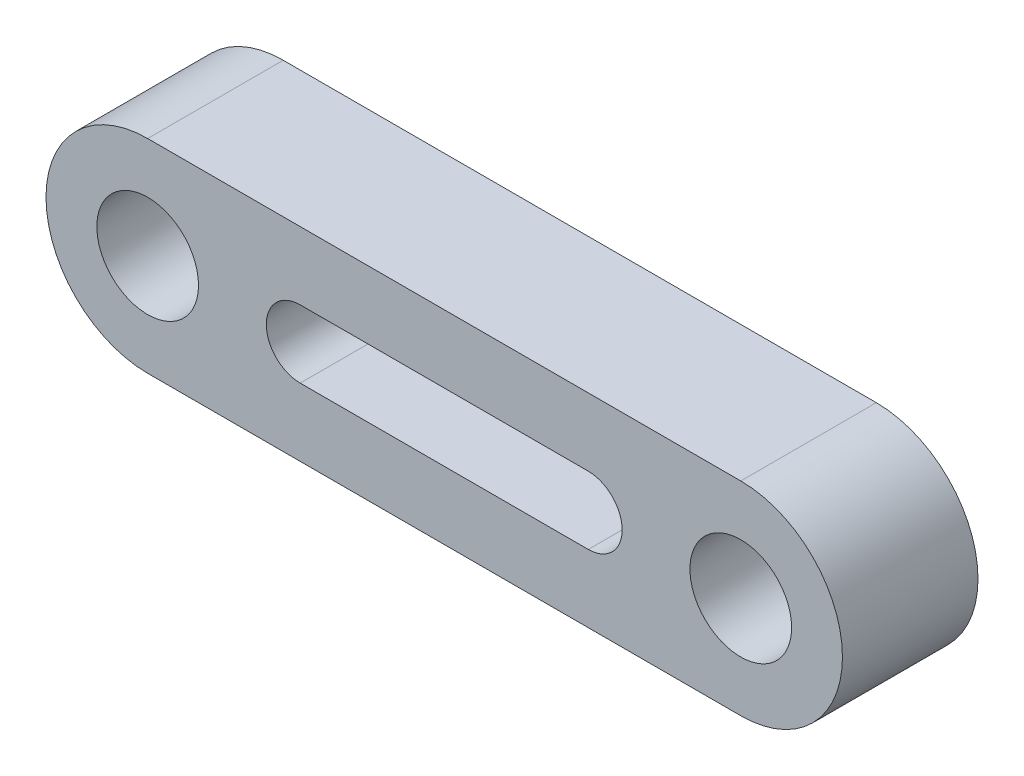
from build123d import *

# Parameters (mm, degrees)
ESQUISSE1_R             = 1.5
BOSS_EXTRU_1_DEPTH      = 4
ENL_V_MAT_EXTRU_1_REACH = 23.101


with BuildPart() as part:
    # Esquisse1 → Boss.-Extru.1 (new body)
    with BuildSketch(Plane.XY):
        with BuildLine():
            Line((0, 3), (17.5, 3))
            ThreePointArc((17.5, 3), (20.5, 0), (17.5, -3))
            Line((17.5, -3), (0, -3))
            ThreePointArc((0, -3), (-3, 0), (0, 3))
        make_face()
        Circle(ESQUISSE1_R, mode=Mode.SUBTRACT)
        with Locations((17.5, 0)):
            Circle(ESQUISSE1_R, mode=Mode.SUBTRACT)
    extrude(amount=BOSS_EXTRU_1_DEPTH)

    # Esquisse2 → Enlèv. mat.-Extru.1 (cut, up to next)
    with BuildSketch(Plane.XY.offset(4), mode=Mode.PRIVATE) as enl_v_mat_extru_1_sk1:
        with BuildLine():
            Line((4.5, 1), (13, 1))
            ThreePointArc((13, 1), (14, 0), (13, -1))
            Line((13, -1), (4.5, -1))
            ThreePointArc((4.5, -1), (3.5, 0), (4.5, 1))
        make_face()
    enl_v_mat_extru_1_tool1 = extrude(enl_v_mat_extru_1_sk1.sketch, amount=-ENL_V_MAT_EXTRU_1_REACH, mode=Mode.PRIVATE) & part.part
    add(enl_v_mat_extru_1_tool1.solids().sort_by_distance((8.75, 0, 4))[0], mode=Mode.SUBTRACT)


solid = part.part
